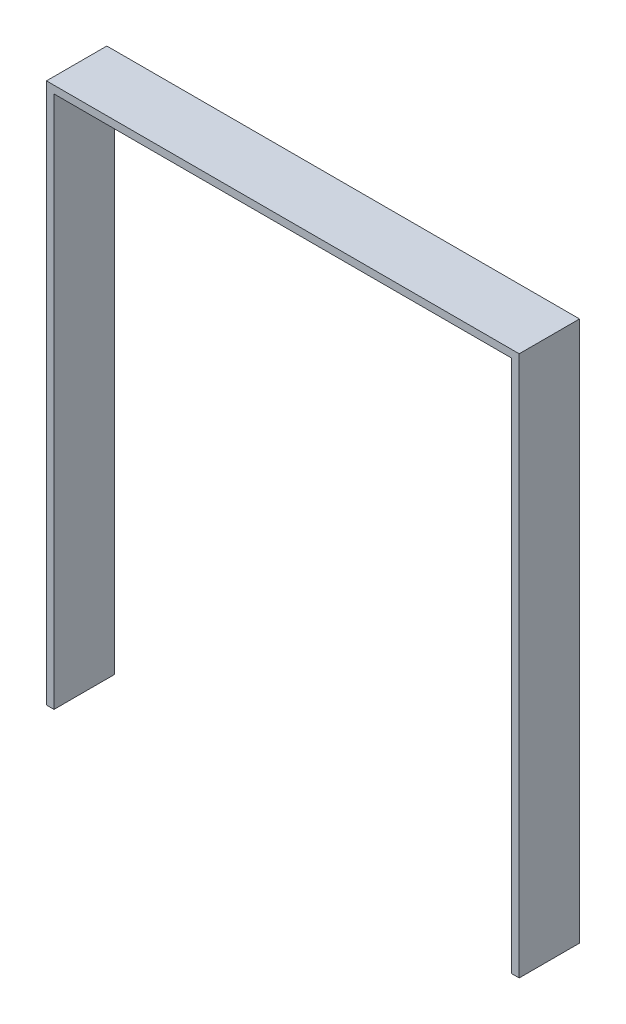
from build123d import *

# Parameters (mm, degrees)
EXTRUDE_2_DEPTH = 24


with BuildPart() as part:
    # 草图1 → Extrude 2 (new body)
    with BuildSketch(Plane.XY):
        Polygon((-3, 0), (-3, 215), (185, 215), (185, 0), (182, 0), (182, 212), (0, 212), (0, 0), align=None)
    extrude(amount=EXTRUDE_2_DEPTH)


solid = part.part
